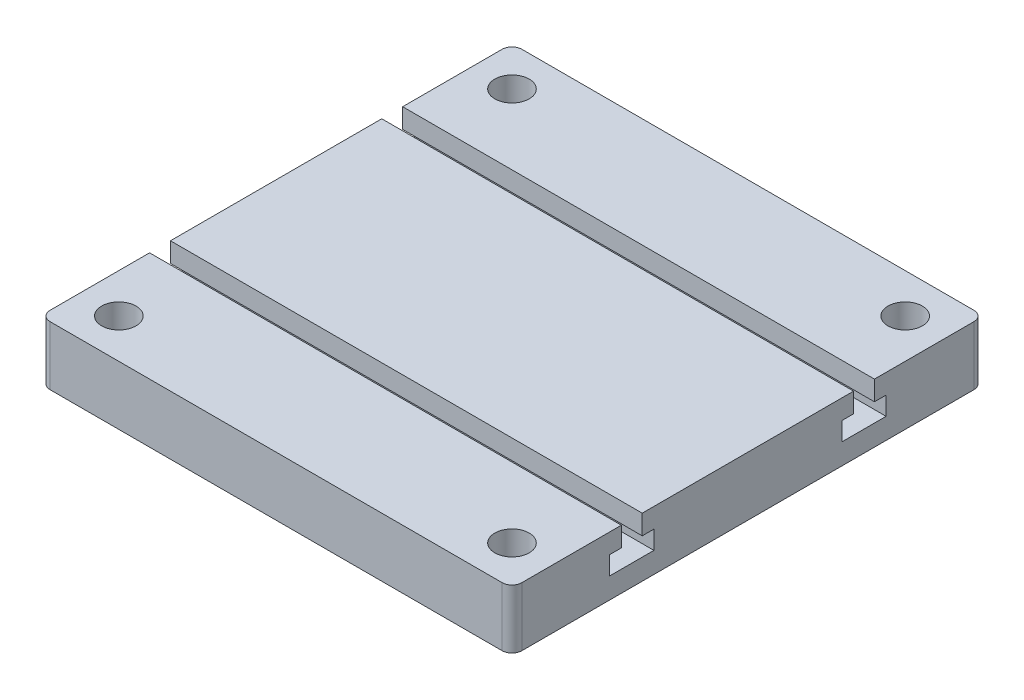
from build123d import *

# Parameters (mm, degrees)
SKETCH1_W                                        = 152.4
SKETCH1_H                                        = 152.4
BOSS_EXTRUDE1_DEPTH                              = 19.05
CBORE_FOR_1_4_SOCKET_HEAD_CAP_SCREW1_D           = 6.5278
CBORE_FOR_1_4_SOCKET_HEAD_CAP_SCREW1_CBORE_D     = 11.1125
CBORE_FOR_1_4_SOCKET_HEAD_CAP_SCREW1_CBORE_DEPTH = 8.89
T_SLOT_CUT_WITH_MCMASTER_8789A16_BIT_DEPTH       = 172.45
FILLET1_R                                        = 3.175


with BuildPart() as part:
    # Sketch1 → Boss-Extrude1 (new body)
    with BuildSketch(Plane(origin=(0, 0, 0), x_dir=(1, 0, 0), z_dir=(0, 1, 0))):
        Rectangle(SKETCH1_W, SKETCH1_H)
    extrude(amount=BOSS_EXTRUDE1_DEPTH)

    # CBORE for 1/4 Socket Head Cap Screw1 (through all)
    with Locations(Plane(origin=(0, 19.05, 0), x_dir=(1, 0, 0), z_dir=(0, 1, 0))):
        with Locations((-63.5, 63.5), (63.5, 63.5), (63.5, -63.5), (-63.5, -63.5)):
            CounterBoreHole(CBORE_FOR_1_4_SOCKET_HEAD_CAP_SCREW1_D / 2, CBORE_FOR_1_4_SOCKET_HEAD_CAP_SCREW1_CBORE_D / 2, CBORE_FOR_1_4_SOCKET_HEAD_CAP_SCREW1_CBORE_DEPTH)

    # Sketch4 → T-SLOT CUT WITH MCMASTER 8789A16 BIT (cut, through all)
    with BuildSketch(Plane(origin=(-76.2, 0, 0), x_dir=(0, 0, -1), z_dir=(1, 0, 0))):
        Polygon((-40.8765375, 19.05), (-40.8765375, 12.7), (-44.64685, 12.7), (-44.64685, 6.746875), (-30.35935, 6.746875), (-30.35935, 12.7), (-34.1296625, 12.7), (-34.1296625, 19.05), align=None)
        Polygon((34.1296625, 12.7), (34.1296625, 19.05), (40.8765375, 19.05), (40.8765375, 12.7), (44.64685, 12.7), (44.64685, 6.746875), (30.35935, 6.746875), (30.35935, 12.7), align=None)
    extrude(amount=T_SLOT_CUT_WITH_MCMASTER_8789A16_BIT_DEPTH, mode=Mode.SUBTRACT)

    # Fillet1
    fillet1_edges = [part.edges().sort_by_distance(p)[0] for p in [
        (76.2, 9.525, 76.2),
        (-76.2, 9.525, 76.2),
        (-76.2, 9.525, -76.2),
        (76.2, 9.525, -76.2),
    ]]
    fillet(fillet1_edges, radius=FILLET1_R)


solid = part.part
